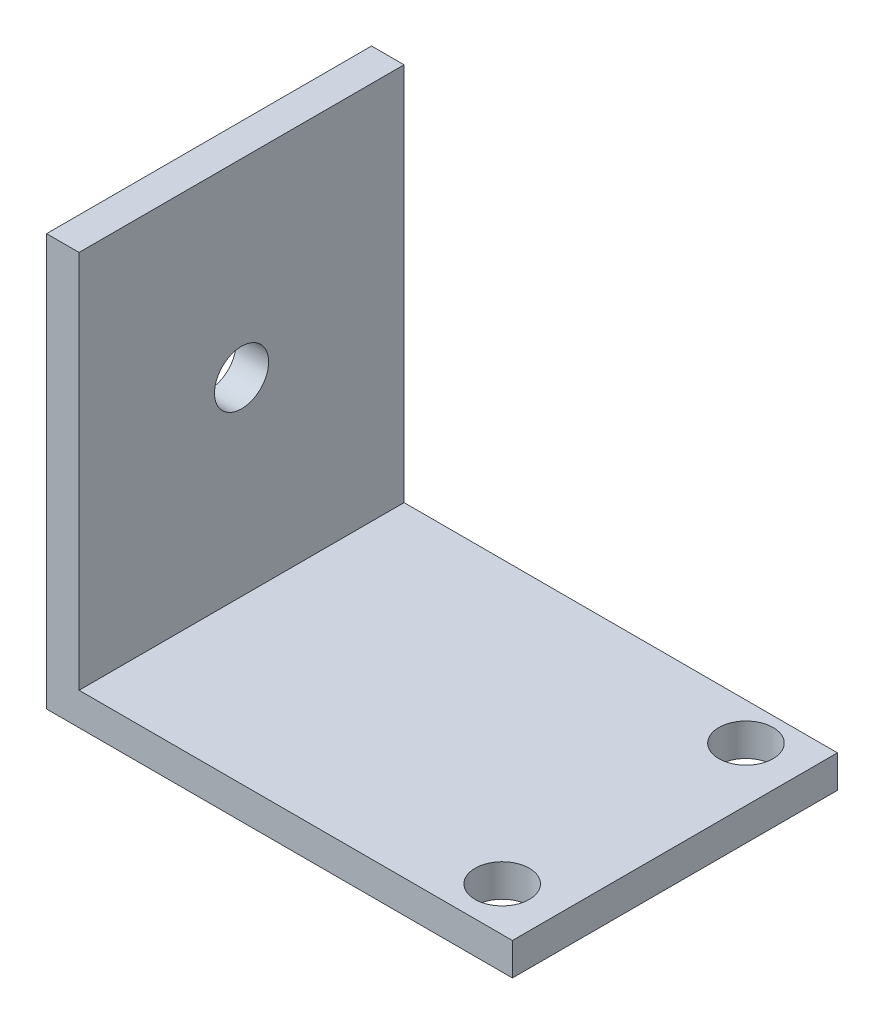
from build123d import *

# Parameters (mm, degrees)
EXTRUDE_THIN1_DEPTH = 60
SKETCH2_R           = 5
CUT_EXTRUDE1_DEPTH  = 123.065556157
SKETCH3_R           = 5
CUT_EXTRUDE2_DEPTH  = 123.065556157


with BuildPart() as part:
    # Sketch1 → Extrude-Thin1 (new body)
    with BuildSketch(Plane.XY):
        Polygon((80, 0), (0, 0), (0, 70), (-6, 70), (-6, -6), (80, -6), align=None)
    extrude(amount=EXTRUDE_THIN1_DEPTH)

    # Sketch2 → Cut-Extrude1 (cut, through all)
    with BuildSketch(Plane(origin=(0, 0, 0), x_dir=(1, 0, 0), z_dir=(0, 1, 0))):
        with Locations(Location((70, -6.887679605, 0), (0, 0, 270))):
            Circle(SKETCH2_R)
        with Locations(Location((70, -51.887679605, 0), (0, 0, 270))):
            Circle(SKETCH2_R)
    extrude(amount=-CUT_EXTRUDE1_DEPTH, mode=Mode.SUBTRACT)

    # Sketch3 → Cut-Extrude2 (cut, through all)
    with BuildSketch(Plane(origin=(0, 0, 0), x_dir=(0, 0, -1), z_dir=(1, 0, 0))):
        with Locations((-30, 35)):
            Circle(SKETCH3_R)
    extrude(amount=-CUT_EXTRUDE2_DEPTH, mode=Mode.SUBTRACT)


solid = part.part
